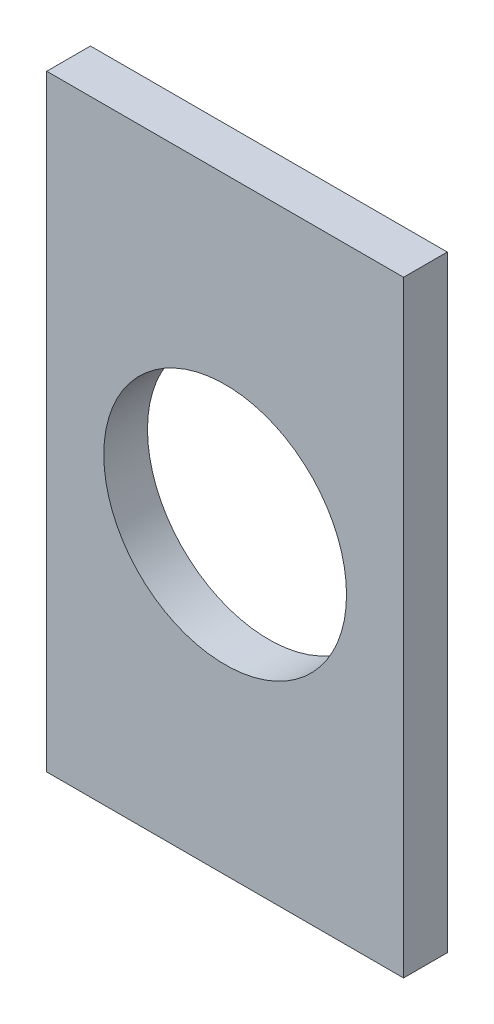
from build123d import *

# Parameters (mm, degrees)
SKETCH1_W           = 14.7
SKETCH1_H           = 25
SKETCH1_R           = 5
BOSS_EXTRUDE1_DEPTH = 0.9


with BuildPart() as part:
    # Sketch1 → Boss-Extrude1 (new, symmetric)
    with BuildSketch(Plane.XY):
        Rectangle(SKETCH1_W, SKETCH1_H)
        Circle(SKETCH1_R, mode=Mode.SUBTRACT)
    extrude(amount=BOSS_EXTRUDE1_DEPTH, both=True)


solid = part.part
